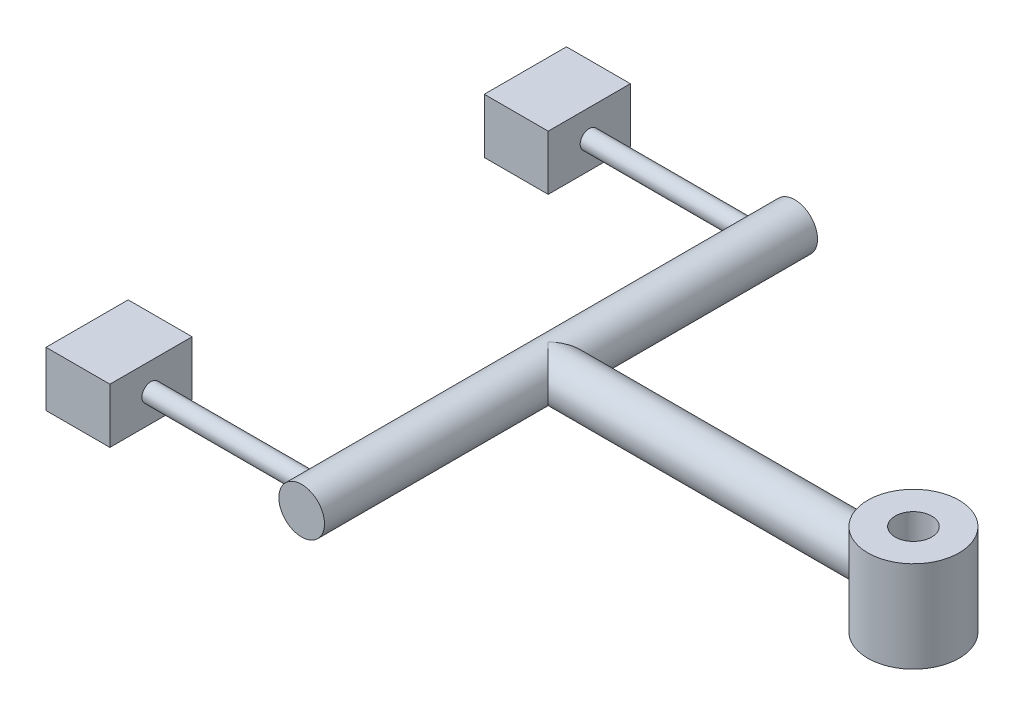
from build123d import *

# Parameters (mm, degrees)
SKETCH1_W           = 400
SKETCH1_H           = 25
SKETCH2_W           = 25
SKETCH2_H           = 540
SKETCH4_R           = 50
BOSS_EXTRUDE1_DEPTH = 50
SKETCH5_W           = 200
SKETCH5_H           = 10
SKETCH6_R           = 20
CUT_EXTRUDE1_DEPTH  = 621.805927955
SKETCH7_W           = 70
SKETCH7_H           = 90
BOSS_EXTRUDE2_DEPTH = 30
CUT_EXTRUDE2_DEPTH  = 20
SKETCH10_W          = 53.225586826
SKETCH10_H          = 20
CUT_EXTRUDE3_DEPTH  = 40


with BuildPart() as part:
    # Sketch1 → Revolve1 (revolve)
    with BuildSketch(Plane(origin=(0, 0, 0), x_dir=(1, 0, 0), z_dir=(0, 1, 0))):
        with Locations((-150, -12.5)):
            Rectangle(SKETCH1_W, SKETCH1_H)
    revolve(axis=Axis((-350, 0, 0), (1, 0, 0)))

    # Sketch2 → Revolve2 (revolve)
    with BuildSketch(Plane(origin=(0, 0, 0), x_dir=(1, 0, 0), z_dir=(0, 1, 0)), mode=Mode.PRIVATE) as revolve2_sk:
        with Locations((-362.5, 0)):
            Rectangle(SKETCH2_W, SKETCH2_H)
    revolve(revolve2_sk.sketch.rotate(Axis((-350, 0, 270), (0, 0, -1)), 180), axis=Axis((-350, 0, 270), (0, 0, -1)))

    # Sketch4 → Boss-Extrude1 (add, symmetric)
    with BuildSketch(Plane(origin=(0, 0, 0), x_dir=(1, 0, 0), z_dir=(0, 1, 0))):
        with Locations(Location((50, 0, 0), (0, 0, 270))):
            Circle(SKETCH4_R)
    extrude(amount=BOSS_EXTRUDE1_DEPTH, both=True)

    # Sketch5 → Revolve-Thin1 (revolve)
    with BuildSketch(Plane(origin=(0, 0, 0), x_dir=(1, 0, 0), z_dir=(0, 1, 0)), mode=Mode.PRIVATE) as revolve_thin1_sk:
        with Locations((-450, 235)):
            Rectangle(SKETCH5_W, SKETCH5_H)
    revolve_thin1 = revolve(revolve_thin1_sk.sketch.rotate(Axis((-350, 0, -240), (-1, 0, 0)), 180), axis=Axis((-350, 0, -240), (-1, 0, 0)))

    # Mirror2: Revolve-Thin1 across plane
    add(revolve_thin1.mirror(Plane.XY))

    # Sketch6 → Cut-Extrude1 (cut, through all)
    with BuildSketch(Plane(origin=(0, 50, 0), x_dir=(1, 0, 0), z_dir=(0, 1, 0))):
        with Locations(Location((50, 0, 0), (0, 0, 270))):
            Circle(SKETCH6_R)
    extrude(amount=-CUT_EXTRUDE1_DEPTH, mode=Mode.SUBTRACT)

    # Sketch7 → Boss-Extrude2 (add, symmetric)
    with BuildSketch(Plane(origin=(0, 0, 0), x_dir=(1, 0, 0), z_dir=(0, 1, 0))):
        with Locations((-580, -240)):
            Rectangle(SKETCH7_W, SKETCH7_H)
    boss_extrude2 = extrude(amount=BOSS_EXTRUDE2_DEPTH, both=True)

    # Sketch9 → Cut-Extrude2 (cut, symmetric)
    with BuildSketch(Plane(origin=(0, 0, 0), x_dir=(1, 0, 0), z_dir=(0, 1, 0))):
        Polygon((-575, -281.612233807), (-615, -281.612233807), (-615, -201.612233807), (-575, -201.612233807), (-555, -201.612233807), (-555, -281.612233807), align=None)
        with BuildLine():
            Line((-598, -265), (-602, -265))
            ThreePointArc((-602, -265), (-604.121320344, -264.121320344), (-605, -262))
            Line((-605, -262), (-605, -221.224467614))
            ThreePointArc((-605, -221.224467614), (-604.121320344, -219.103147271), (-602, -218.224467614))
            Line((-602, -218.224467614), (-598, -218.224467614))
            ThreePointArc((-598, -218.224467614), (-595.878679656, -219.103147271), (-595, -221.224467614))
            Line((-595, -221.224467614), (-595, -262))
            ThreePointArc((-595, -262), (-595.878679656, -264.121320344), (-598, -265))
        make_face(mode=Mode.SUBTRACT)
    cut_extrude2 = extrude(amount=CUT_EXTRUDE2_DEPTH, both=True, mode=Mode.SUBTRACT)

    # Sketch10 → Cut-Extrude3 (cut)
    with BuildSketch(Plane.ZY.offset(605)):
        with Locations((240, 0)):
            Rectangle(SKETCH10_W, SKETCH10_H)
    cut_extrude3 = extrude(amount=-CUT_EXTRUDE3_DEPTH, mode=Mode.SUBTRACT)

    # Mirror3: Boss-Extrude2, Cut-Extrude2, Cut-Extrude3 across plane
    add(boss_extrude2.mirror(Plane.XY))
    add(cut_extrude2.mirror(Plane.XY), mode=Mode.SUBTRACT)
    add(cut_extrude3.mirror(Plane.XY), mode=Mode.SUBTRACT)


solid = part.part
